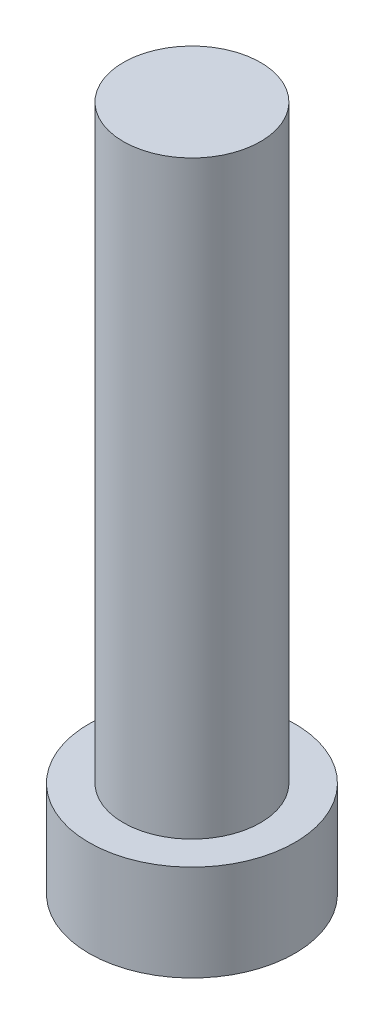
from build123d import *

# Parameters (mm, degrees)
SKETCH1_R           = 7.5
SKETCH1_R_2         = 5
BOSS_EXTRUDE1_DEPTH = 7
SKETCH1_2_R         = 5
BOSS_EXTRUDE2_DEPTH = 50


with BuildPart() as part:
    # Sketch1 → Boss-Extrude1 (new body)
    with BuildSketch(Plane(origin=(0, 0, 0), x_dir=(1, 0, 0), z_dir=(0, 1, 0))):
        Circle(SKETCH1_R)
        Circle(SKETCH1_R_2, mode=Mode.SUBTRACT)
    extrude(amount=BOSS_EXTRUDE1_DEPTH)

    # Sketch1<2> → Boss-Extrude2 (add)
    with BuildSketch(Plane(origin=(0, 0, 0), x_dir=(1, 0, 0), z_dir=(0, 1, 0))):
        Circle(SKETCH1_2_R)
    extrude(amount=BOSS_EXTRUDE2_DEPTH)


solid = part.part
